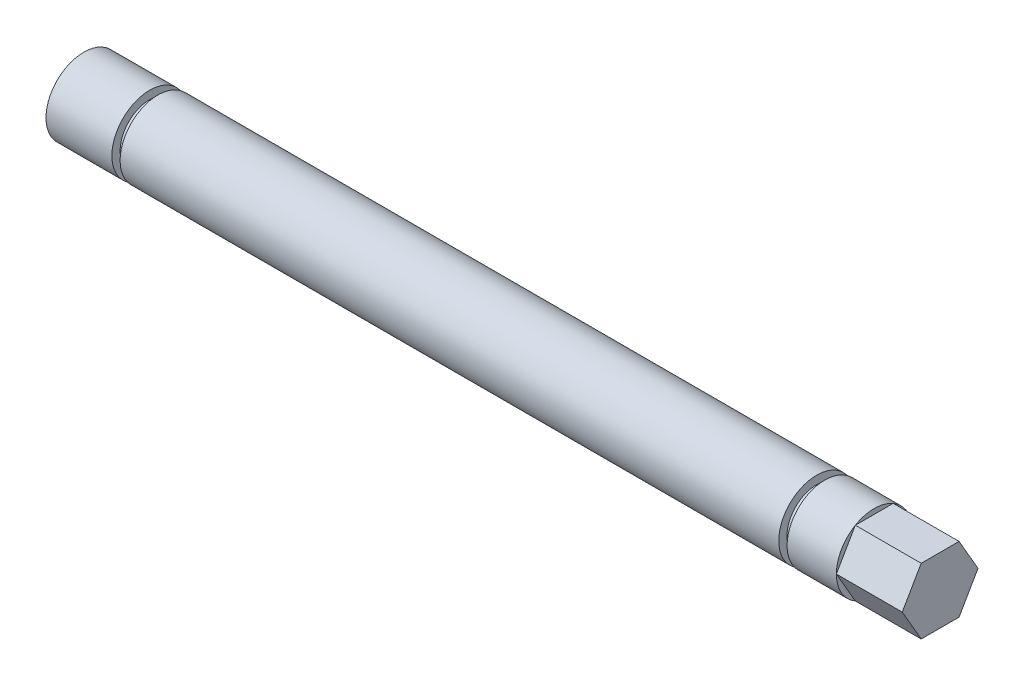
from build123d import *

# Parameters (mm, degrees)
SKETCH1_R           = 7.3025
BOSS_EXTRUDE1_DEPTH = 165.1
SKETCH2_W           = 1.5875
SKETCH2_H           = 1.5875
SKETCH4_R           = 7.3025
SKETCH4_R_2         = 5.715
CUT_EXTRUDE1_DEPTH  = 1.6002
SKETCH5_OUTSIDE_W   = 49.882
SKETCH5_OUTSIDE_H   = 49.882
CUT_EXTRUDE2_DEPTH  = 12.7


with BuildPart() as part:
    # Sketch1 → Boss-Extrude1 (new body)
    with BuildSketch(Plane(origin=(0, 0, 0), x_dir=(0, 0, -1), z_dir=(1, 0, 0))):
        Circle(SKETCH1_R)
    extrude(amount=BOSS_EXTRUDE1_DEPTH)

    # Sketch2 → Groove (revolve, cut)
    with BuildSketch(Plane.XY, mode=Mode.PRIVATE) as groove_sk:
        with Locations((13.49375, 6.50875)):
            Rectangle(SKETCH2_W, SKETCH2_H)
    revolve(groove_sk.sketch.rotate(Axis((0, 0, 0), (1, 0, 0)), 90), axis=Axis((0, 0, 0), (1, 0, 0)), mode=Mode.SUBTRACT)

    # Sketch4 → Cut-Extrude1 (cut)
    with BuildSketch(Plane.ZY.offset(-141.2875)):
        Circle(SKETCH4_R)
        Circle(SKETCH4_R_2, mode=Mode.SUBTRACT)
    extrude(amount=-CUT_EXTRUDE1_DEPTH, mode=Mode.SUBTRACT)

    # Sketch5 outside → Cut-Extrude2 (cut)
    with BuildSketch(Plane(origin=(165.1, 0, 0), x_dir=(0, 0, -1), z_dir=(1, 0, 0))):
        Rectangle(SKETCH5_OUTSIDE_W, SKETCH5_OUTSIDE_H)
        Polygon((7.3025, 0), (3.65125, 6.324150511), (-3.65125, 6.324150511), (-7.3025, 0), (-3.65125, -6.324150511), (3.65125, -6.324150511), align=None, mode=Mode.SUBTRACT)
    extrude(amount=-CUT_EXTRUDE2_DEPTH, mode=Mode.SUBTRACT)


solid = part.part
